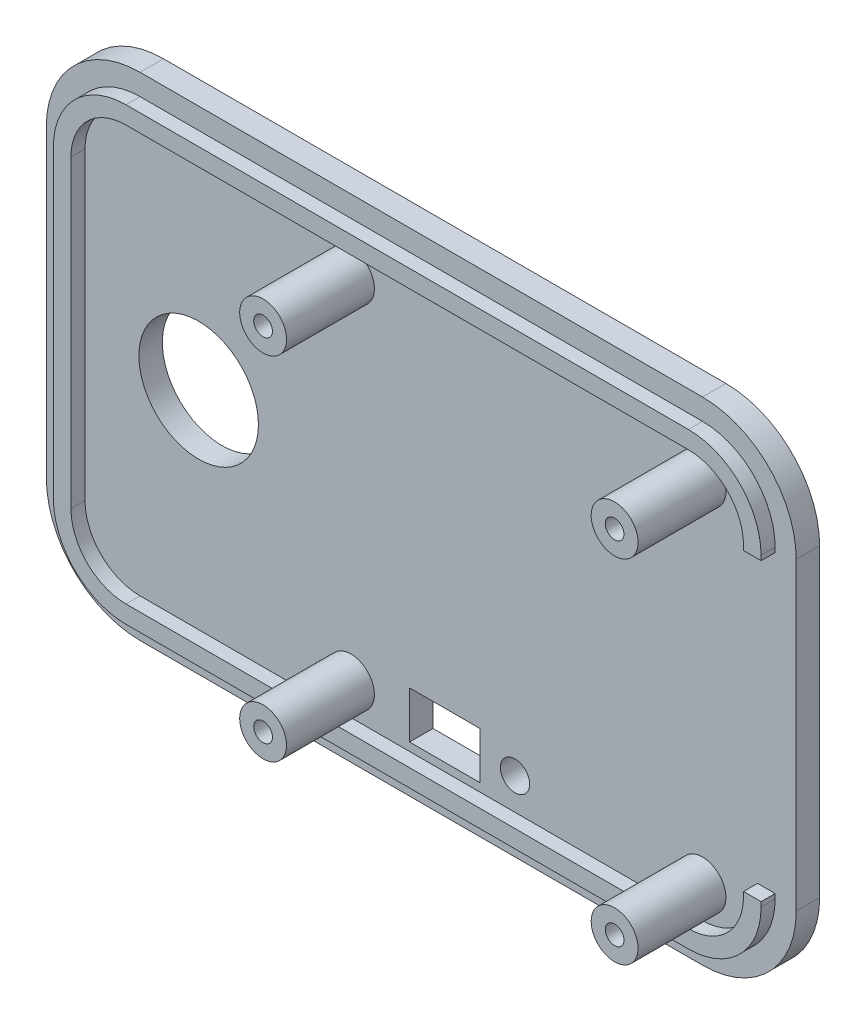
from build123d import *

# Parameters (mm, degrees)
SKETCH1_W           = 64
SKETCH1_H           = 42
BOSS_EXTRUDE1_DEPTH = 2
FILLET1_R           = 8
BOSS_EXTRUDE2_DEPTH = 1.2
SKETCH3_W           = 6
SKETCH3_H           = 25.2
CUT_EXTRUDE1_DEPTH  = 1.2
SKETCH4_R           = 2
BOSS_EXTRUDE3_DEPTH = 7.5
SKETCH5_R           = 0.8
CUT_EXTRUDE2_DEPTH  = 5
SKETCH6_R           = 5.1
SKETCH6_R_2         = 1.25
SKETCH6_W           = 6
SKETCH6_H           = 4
CUT_EXTRUDE3_DEPTH  = 40.003204997


with BuildPart() as part:
    # Sketch1 → Boss-Extrude1 (new body)
    with BuildSketch(Plane.XY):
        Rectangle(SKETCH1_W, SKETCH1_H)
    extrude(amount=BOSS_EXTRUDE1_DEPTH)

    # Fillet1
    fillet1_edges = [part.edges().sort_by_distance(p)[0] for p in [
        (-32, 21, 1),
        (32, 21, 1),
        (32, -21, 1),
        (-32, -21, 1),
    ]]
    fillet(fillet1_edges, radius=FILLET1_R)

    # Sketch2 → Boss-Extrude2 (add)
    with BuildSketch(Plane.XY.offset(2)):
        with BuildLine():
            Line((-24, 19.2), (24, 19.2))
            ThreePointArc((24, 19.2), (28.384062043, 17.384062043), (30.2, 13))
            Line((30.2, 13), (30.2, -13))
            ThreePointArc((30.2, -13), (28.384062043, -17.384062043), (24, -19.2))
            Line((24, -19.2), (-24, -19.2))
            ThreePointArc((-24, -19.2), (-28.384062043, -17.384062043), (-30.2, -13))
            Line((-30.2, -13), (-30.2, 13))
            ThreePointArc((-30.2, 13), (-28.384062043, 17.384062043), (-24, 19.2))
        make_face()
        with BuildLine():
            Line((-24, 17.7), (24, 17.7))
            ThreePointArc((24, 17.7), (27.323401872, 16.323401872), (28.7, 13))
            Line((28.7, 13), (28.7, -13))
            ThreePointArc((28.7, -13), (27.323401872, -16.323401872), (24, -17.7))
            Line((24, -17.7), (-24, -17.7))
            ThreePointArc((-24, -17.7), (-27.323401872, -16.323401872), (-28.7, -13))
            Line((-28.7, -13), (-28.7, 13))
            ThreePointArc((-28.7, 13), (-27.323401872, 16.323401872), (-24, 17.7))
        make_face(mode=Mode.SUBTRACT)
    extrude(amount=BOSS_EXTRUDE2_DEPTH)

    # Sketch3 → Cut-Extrude1 (cut)
    with BuildSketch(Plane(origin=(0, 0, 2), x_dir=(-1, 0, 0), z_dir=(0, 0, -1))):
        with Locations((-30, 0)):
            Rectangle(SKETCH3_W, SKETCH3_H)
    extrude(amount=-CUT_EXTRUDE1_DEPTH, mode=Mode.SUBTRACT)

    # Sketch4 → Boss-Extrude3 (add)
    with BuildSketch(Plane.XY.offset(2)):
        with Locations((-6, 15)):
            Circle(SKETCH4_R)
        with Locations((24, 15)):
            Circle(SKETCH4_R)
        with Locations(Location((24, -15, 0), (0, 0, 180))):
            Circle(SKETCH4_R)
        with Locations(Location((-6, -15, 0), (0, 0, 180))):
            Circle(SKETCH4_R)
    extrude(amount=BOSS_EXTRUDE3_DEPTH)

    # Sketch5 → Cut-Extrude2 (cut)
    with BuildSketch(Plane.XY.offset(9.5)):
        with Locations((24, 15)):
            Circle(SKETCH5_R)
    cut_extrude2 = extrude(amount=-CUT_EXTRUDE2_DEPTH, mode=Mode.SUBTRACT)

    # Sketch-Pattern1: Cut-Extrude2 at 3 more places
    with Locations((-30, 0, 0), (-30, -30, 0), (0, -30, 0)):
        add(cut_extrude2, mode=Mode.SUBTRACT)

    # Sketch6 → Cut-Extrude3 (cut, through all)
    with BuildSketch(Plane.XY.offset(2)):
        with Locations((-19, 0)):
            Circle(SKETCH6_R)
        with Locations((8, -15)):
            Circle(SKETCH6_R_2)
        with Locations((2, -15)):
            Rectangle(SKETCH6_W, SKETCH6_H)
    extrude(amount=-CUT_EXTRUDE3_DEPTH, mode=Mode.SUBTRACT)


solid = part.part
